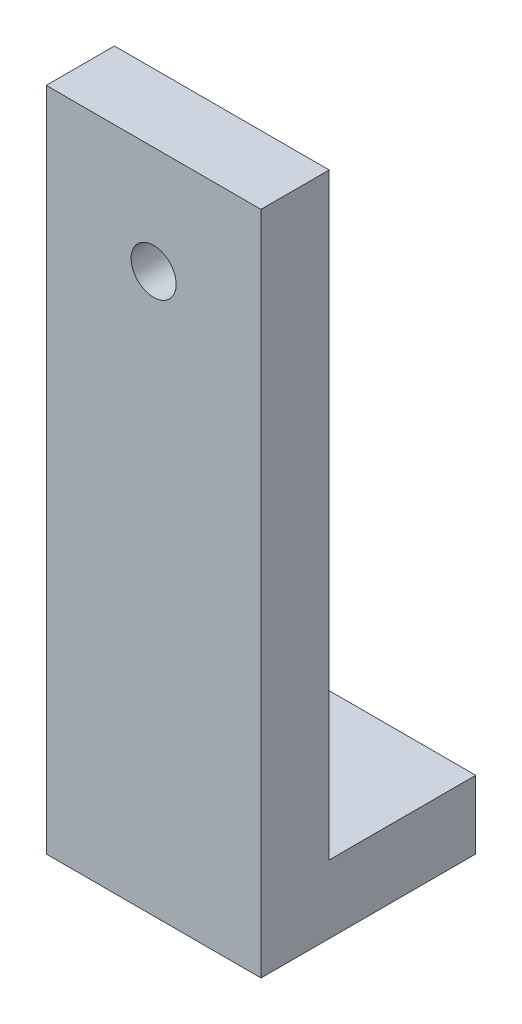
from build123d import *

# Parameters (mm, degrees)
BOSS_EXTRUDE1_DEPTH = 20
M5_TAPPED_HOLE1_D   = 4.2


with BuildPart() as part:
    # Sketch1 → Boss-Extrude1 (new body)
    with BuildSketch(Plane(origin=(0, 0, 0), x_dir=(0, 0, -1), z_dir=(1, 0, 0))):
        Polygon((0, 0), (0, 62), (6.35, 62), (6.35, 6.35), (20, 6.35), (20, 0), align=None)
    extrude(amount=BOSS_EXTRUDE1_DEPTH)

    # M5 Tapped Hole1 (through all)
    with Locations(Plane.XY):
        with Locations((10, 52)):
            Hole(M5_TAPPED_HOLE1_D / 2)


solid = part.part
